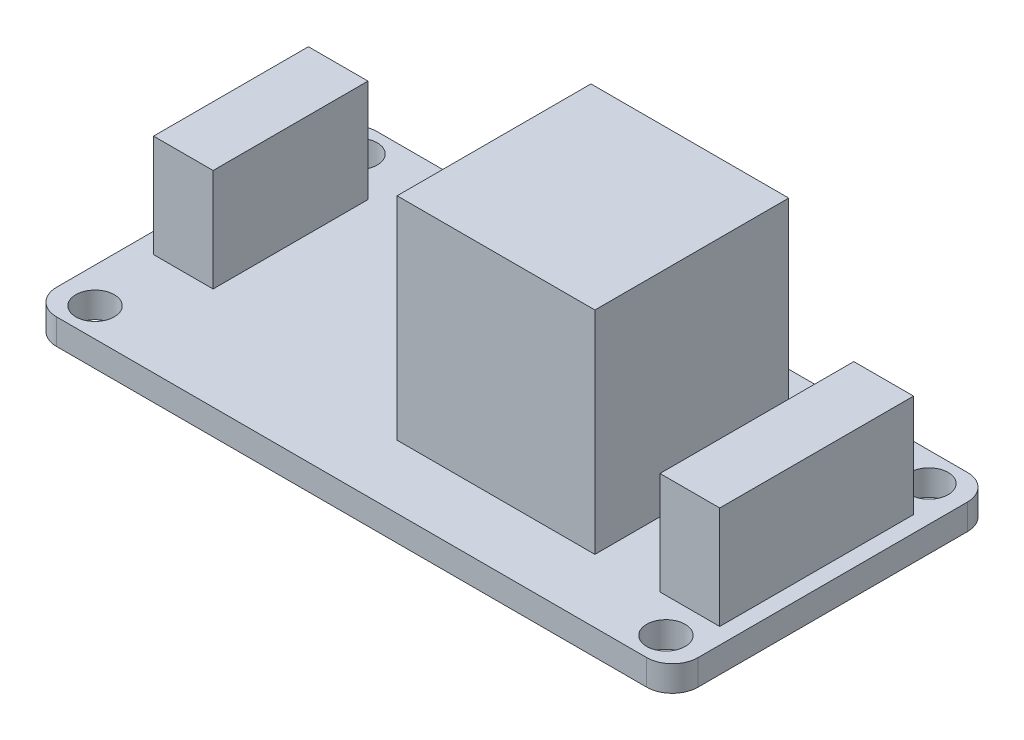
from build123d import *

# Parameters (mm, degrees)
SKETCH_1_W          = 50
SKETCH_1_H          = 25
EXTRUDE_1_DEPTH     = 2
SKETCH_2_W          = 15.416574513
SKETCH_2_H          = 15.10736158
EXTRUDE_2_DEPTH     = 16.5
SKETCH_2_6_W        = 4.657076635
SKETCH_2_6_H        = 15.10736158
SKETCH_2_6_W_2      = 4.64276656
SKETCH_2_6_H_2      = 12.070908618
EXTRUDE_3_DEPTH     = 8
SKETCH_3_R          = 1.5
CUT_EXTRUDE_1_DEPTH = 33.457664734
FILLET_1_R          = 2


with BuildPart() as part:
    # 草图1 → 凸台-拉伸1 (new body)
    with BuildSketch(Plane(origin=(0, 0, 0), x_dir=(1, 0, 0), z_dir=(0, 1, 0))):
        Rectangle(SKETCH_1_W, SKETCH_1_H)
    extrude(amount=EXTRUDE_1_DEPTH)

    # 草图2 → 凸台-拉伸2 (add)
    with BuildSketch(Plane(origin=(0, 2, 0), x_dir=(1, 0, 0), z_dir=(0, 1, 0))):
        with Locations((6.307789338, 0)):
            Rectangle(SKETCH_2_W, SKETCH_2_H)
    extrude(amount=EXTRUDE_2_DEPTH)

    # 草图2<6> → 凸台-拉伸3 (add)
    with BuildSketch(Plane(origin=(0, 2, 0), x_dir=(1, 0, 0), z_dir=(0, 1, 0))):
        with Locations((21.418251887, 0)):
            Rectangle(SKETCH_2_6_W, SKETCH_2_6_H)
        with Locations((-21.10123104, 1.518226481)):
            Rectangle(SKETCH_2_6_W_2, SKETCH_2_6_H_2)
    extrude(amount=EXTRUDE_3_DEPTH)

    # 草图3 → 切除-拉伸1 (cut, through all)
    with BuildSketch(Plane(origin=(0, 2, 0), x_dir=(1, 0, 0), z_dir=(0, 1, 0))):
        with Locations((-22.25, 10.25)):
            Circle(SKETCH_3_R)
        with Locations((22.25, 10.25)):
            Circle(SKETCH_3_R)
        with Locations((22.25, -10.25)):
            Circle(SKETCH_3_R)
        with Locations((-22.25, -10.25)):
            Circle(SKETCH_3_R)
    extrude(amount=-CUT_EXTRUDE_1_DEPTH, mode=Mode.SUBTRACT)

    # 圆角1
    fillet_1_edges = [part.edges().sort_by_distance(p)[0] for p in [
        (25, 1, -12.5),
        (25, 1, 12.5),
        (-25, 1, 12.5),
        (-25, 1, -12.5),
    ]]
    fillet(fillet_1_edges, radius=FILLET_1_R)


solid = part.part
